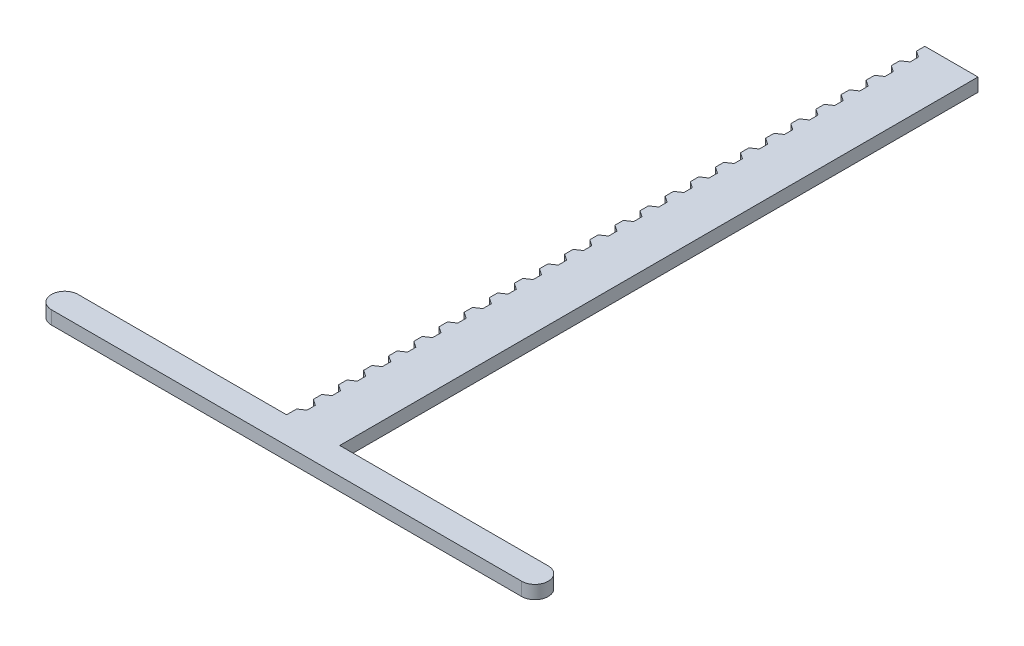
from build123d import *

# Parameters (mm, degrees)
BOSS_EXTRUDE1_DEPTH = 3.175
CUT_EXTRUDE1_DEPTH  = 3.175
LPATTERN1_COUNT     = 25
LPATTERN1_PITCH     = 6


with BuildPart() as part:
    # Sketch1 → Boss-Extrude1 (new body)
    with BuildSketch(Plane(origin=(0, 0, 0), x_dir=(1, 0, 0), z_dir=(0, 1, 0))):
        with BuildLine():
            Line((-6.35, 0), (-56.134, 0))
            ThreePointArc((-56.134, 0), (-59.309, -3.175), (-56.134, -6.35))
            Line((-56.134, -6.35), (56.134, -6.35))
            ThreePointArc((56.134, -6.35), (59.309, -3.175), (56.134, 0))
            Line((56.134, 0), (6.35, 0))
            Line((6.35, 0), (6.35, 152.4))
            Line((6.35, 152.4), (-6.35, 152.4))
            Line((-6.35, 152.4), (-6.35, 0))
        make_face()
    extrude(amount=BOSS_EXTRUDE1_DEPTH)

    # Sketch2 → Cut-Extrude1 (cut)
    with BuildSketch(Plane(origin=(0, 3.175, 0), x_dir=(1, 0, 0), z_dir=(0, 1, 0))):
        Polygon((-6.35, 150.4), (-4.869501466, 149.4), (-4.869501466, 147.4), (-6.35, 146.4), align=None)
    cut_extrude1 = extrude(amount=-CUT_EXTRUDE1_DEPTH, mode=Mode.SUBTRACT)

    # LPattern1: Cut-Extrude1 ×25
    with Locations(*[(0, 0, i * LPATTERN1_PITCH) for i in range(1, LPATTERN1_COUNT)]):
        add(cut_extrude1, mode=Mode.SUBTRACT)


solid = part.part
